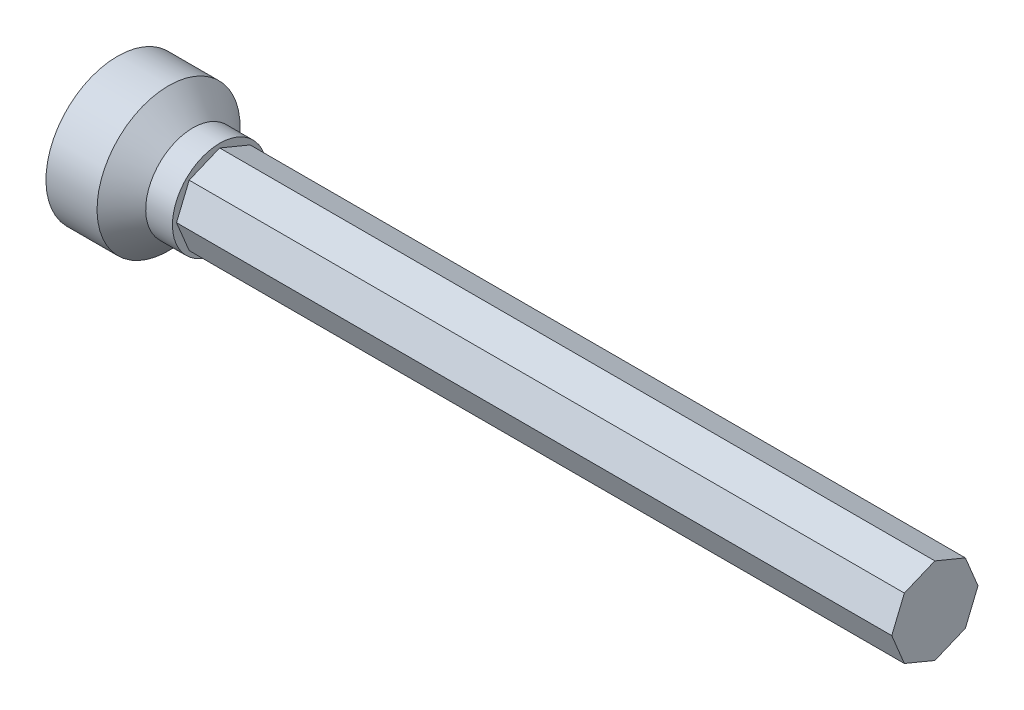
from build123d import *

# Parameters (mm, degrees)
BOSS_EXTRUDE1_DEPTH = 35


with BuildPart() as part:
    # Sketch1 → Boss-Extrude1 (new body)
    with BuildSketch(Plane(origin=(0, 0, 0), x_dir=(0, 0, -1), z_dir=(1, 0, 0))):
        Polygon((-2.110664791, 0), (-1.492465386, -1.492465386), (0, -2.110664791), (1.492465386, -1.492465386), (2.110664791, 0), (1.492465386, 1.492465386), (0, 2.110664791), (-1.492465386, 1.492465386), align=None)
    extrude(amount=BOSS_EXTRUDE1_DEPTH)

    # Sketch4 → Revolve1 (revolve)
    with BuildSketch(Plane.XY):
        Polygon((0, 0), (-5, 0), (-5, 3.5), (-2.5, 3.5), (-1.309401077, 2.309401077), (0, 2.309401077), align=None)
    revolve(axis=Axis((0, 0, 0), (-1, 0, 0)))


solid = part.part
